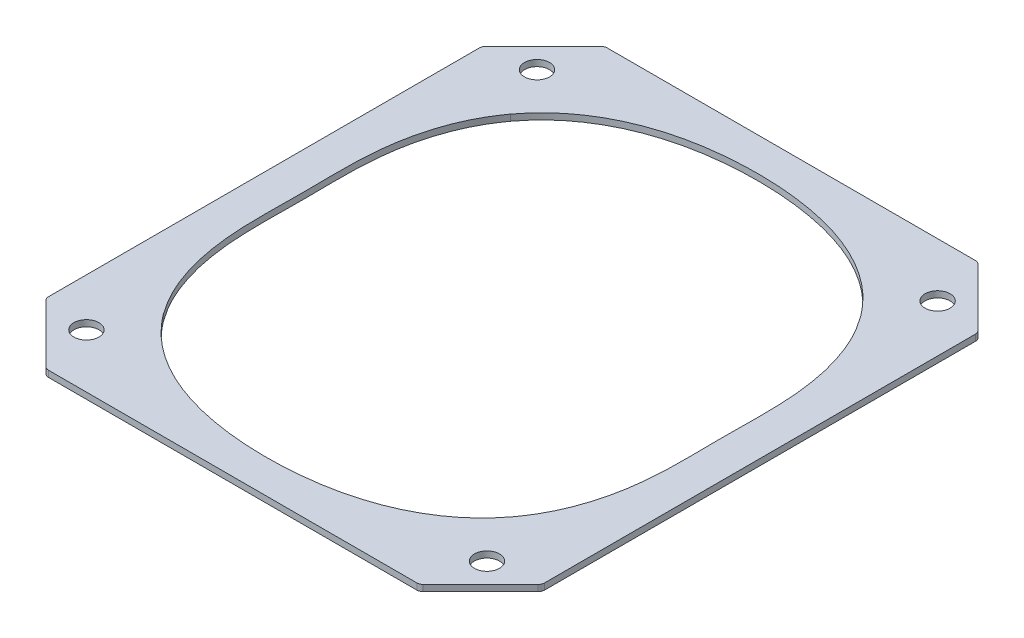
from build123d import *

# Parameters (mm, degrees)
SKETCH_1_R      = 2
EXTRUDE_1_DEPTH = 1


with BuildPart() as part:
    # 草图1 → 凸台-拉伸1 (new body)
    with BuildSketch(Plane.XZ.offset(17.798874667)):
        with BuildLine():
            Line((-395.706204946, -91.903738718), (-395.706204946, -160.757312284))
            ThreePointArc((-395.706204946, -160.757312284), (-395.630097027, -161.139937827), (-395.413356336, -161.464311369))
            Line((-395.413356336, -161.464311369), (-386.224002242, -170.653665463))
            ThreePointArc((-386.224002242, -170.653665463), (-385.8996287, -170.870406154), (-385.517003157, -170.946514073))
            Line((-385.517003157, -170.946514073), (-326.663429591, -170.946514073))
            ThreePointArc((-326.663429591, -170.946514073), (-326.280804048, -170.870406154), (-325.956430506, -170.653665463))
            Line((-325.956430506, -170.653665463), (-316.767076412, -161.464311369))
            ThreePointArc((-316.767076412, -161.464311369), (-316.550335721, -161.139937827), (-316.474227802, -160.757312284))
            Line((-316.474227802, -160.757312284), (-316.474227802, -91.903738718))
            ThreePointArc((-316.474227802, -91.903738718), (-316.550335721, -91.521113175), (-316.767076412, -91.196739633))
            Line((-316.767076412, -91.196739633), (-325.956430506, -82.007385539))
            ThreePointArc((-325.956430506, -82.007385539), (-326.280804048, -81.790644848), (-326.663429591, -81.714536929))
            Line((-326.663429591, -81.714536929), (-385.517003157, -81.714536929))
            ThreePointArc((-385.517003157, -81.714536929), (-385.8996287, -81.790644848), (-386.224002242, -82.007385539))
            Line((-386.224002242, -82.007385539), (-395.413356336, -91.196739633))
            ThreePointArc((-395.413356336, -91.196739633), (-395.630097027, -91.521113175), (-395.706204946, -91.903738718))
        make_face()
        with Locations(Location((-388.090216374, -90.330525501, 0), (0, 0, 270))):
            Circle(SKETCH_1_R, mode=Mode.SUBTRACT)
        with Locations(Location((-324.090216374, -90.330525501, 0), (0, 0, 270))):
            Circle(SKETCH_1_R, mode=Mode.SUBTRACT)
        with Locations(Location((-324.090216374, -162.330525501, 0), (0, 0, 270))):
            Circle(SKETCH_1_R, mode=Mode.SUBTRACT)
        with Locations(Location((-388.090216374, -162.330525501, 0), (0, 0, 270))):
            Circle(SKETCH_1_R, mode=Mode.SUBTRACT)
        with BuildLine():
            add(Edge.make_bspline(
                [(-328.115549043, -154.074705918), (-328.521110277, -154.59950882), (-328.935951097, -155.116186146), (-329.806169809, -156.114044907), (-330.260453195, -156.596991611), (-331.213350311, -157.520739064), (-331.707900164, -157.955834459), (-332.723346196, -158.787049549), (-333.244315955, -159.183060394), (-334.848936349, -160.309387169), (-335.972388004, -160.980823062), (-337.731348119, -161.87882583), (-338.332266211, -162.161075436), (-339.54151706, -162.683417257), (-340.150623092, -162.924120409), (-343.216470166, -164.034826977), (-345.733148117, -164.631034044), (-349.574949627, -165.220267596), (-350.866884926, -165.364900576), (-353.472874642, -165.553124722), (-354.790025345, -165.596406642), (-358.712924122, -165.592375715), (-361.308871291, -165.414172312), (-365.167942823, -164.830251401), (-366.448430665, -164.582286392), (-368.358111819, -164.109940734), (-368.99453183, -163.935229374), (-370.254220123, -163.552000312), (-370.876741702, -163.343828387), (-372.721697987, -162.668191611), (-373.921848978, -162.150340028), (-375.669495279, -161.254671187), (-376.243225263, -160.936174353), (-377.371642786, -160.256122939), (-377.926429949, -159.894182142), (-378.998067992, -159.136743168), (-379.517159279, -158.739902065), (-380.523601029, -157.91183415), (-381.01071538, -157.480351552), (-381.943283382, -156.572254171), (-382.389831683, -156.096825252), (-383.249518774, -155.109773972), (-383.661413356, -154.596803725), (-384.064883145, -154.074706668)],
                knots=[0, 0, 0, 0, 0.03125, 0.03125, 0.0625, 0.0625, 0.09375, 0.09375, 0.125, 0.125, 0.1875, 0.1875, 0.21875, 0.21875, 0.25, 0.25, 0.375, 0.375, 0.4375, 0.4375, 0.5, 0.5, 0.625, 0.625, 0.6875, 0.6875, 0.71875, 0.71875, 0.75, 0.75, 0.8125, 0.8125, 0.84375, 0.84375, 0.875, 0.875, 0.90625, 0.90625, 0.9375, 0.9375, 0.96875, 0.96875, 1, 1, 1, 1], degree=3))
            add(Edge.make_bspline(
                [(-384.064883145, -154.074706668), (-384.765407707, -153.0864132), (-385.42732094, -152.076153161), (-386.292484546, -150.488109085), (-386.559459675, -149.946579027), (-387.059276771, -148.844100038), (-387.291729743, -148.282508818), (-388.359546252, -145.46132493), (-388.939276666, -143.138851633), (-389.482665418, -139.577278966), (-389.611388551, -138.374314162), (-389.781266573, -135.965239718), (-389.822006502, -134.76010621), (-389.851460561, -132.349137318), (-389.839404608, -131.143291545), (-389.811274153, -128.731545786), (-389.79638992, -127.525661857), (-389.796563394, -125.114297943), (-389.811529784, -123.908816727), (-389.839623007, -121.497829476), (-389.851459361, -120.292359943), (-389.821592912, -117.886702654), (-389.780638177, -116.686362914), (-389.611853133, -114.293992905), (-389.484842639, -113.101884222), (-389.123813463, -110.727901972), (-388.888904034, -109.546113603), (-388.436003689, -107.783047131), (-388.268720755, -107.197789125), (-387.904764869, -106.045116113), (-387.707679153, -105.475910785), (-387.281297017, -104.352704238), (-387.051446913, -103.79896437), (-386.556282004, -102.708224696), (-386.291397985, -102.171021551), (-385.430552687, -100.590656677), (-384.768336475, -99.578768629), (-384.064883703, -98.58634508)],
                knots=[0, 0, 0, 0, 0.0625, 0.0625, 0.09375, 0.09375, 0.125, 0.125, 0.25, 0.25, 0.3125, 0.3125, 0.375, 0.375, 0.4375, 0.4375, 0.5, 0.5, 0.5625, 0.5625, 0.625, 0.625, 0.6875, 0.6875, 0.75, 0.75, 0.8125, 0.8125, 0.84375, 0.84375, 0.875, 0.875, 0.90625, 0.90625, 0.9375, 0.9375, 1, 1, 1, 1], degree=3))
            add(Edge.make_bspline(
                [(-384.064883703, -98.58634508), (-383.659322468, -98.061542177), (-383.244481649, -97.544864852), (-382.374262935, -96.547006091), (-381.91997955, -96.064059387), (-380.967082434, -95.140311933), (-380.47253258, -94.705216539), (-379.457086548, -93.874001449), (-378.93611679, -93.477990604), (-377.331496396, -92.35166383), (-376.208044739, -91.680227937), (-374.449084625, -90.782225169), (-373.848166533, -90.499975563), (-372.638915684, -89.977633743), (-372.029809651, -89.73693059), (-368.963962577, -88.626224023), (-366.447284626, -88.030016957), (-362.605483116, -87.440783404), (-361.313547818, -87.296150424), (-358.707558102, -87.107926278), (-357.390407398, -87.064644358), (-353.467508621, -87.068675286), (-350.871561452, -87.24687869), (-347.01248992, -87.830799602), (-345.732002079, -88.078764611), (-343.822320925, -88.55111027), (-343.185900913, -88.72582163), (-341.92621262, -89.109050692), (-341.303691042, -89.317222617), (-339.458734756, -89.992859393), (-338.258583765, -90.510710976), (-336.510937465, -91.406379817), (-335.937207481, -91.724876651), (-334.808789958, -92.404928066), (-334.254002795, -92.766868862), (-333.182364752, -93.524307837), (-332.663273465, -93.92114894), (-331.656831716, -94.749216855), (-331.169717364, -95.180699453), (-330.237149362, -96.088796835), (-329.790601062, -96.564225753), (-328.930913971, -97.551277033), (-328.519019389, -98.064247281), (-328.1155496, -98.586344338)],
                knots=[0, 0, 0, 0, 0.03125, 0.03125, 0.0625, 0.0625, 0.09375, 0.09375, 0.125, 0.125, 0.1875, 0.1875, 0.21875, 0.21875, 0.25, 0.25, 0.375, 0.375, 0.4375, 0.4375, 0.5, 0.5, 0.625, 0.625, 0.6875, 0.6875, 0.71875, 0.71875, 0.75, 0.75, 0.8125, 0.8125, 0.84375, 0.84375, 0.875, 0.875, 0.90625, 0.90625, 0.9375, 0.9375, 0.96875, 0.96875, 1, 1, 1, 1], degree=3))
            add(Edge.make_bspline(
                [(-328.1155496, -98.586344338), (-327.415025038, -99.574637805), (-326.753111806, -100.584897844), (-325.8879482, -102.17294192), (-325.620973071, -102.714471978), (-325.121155975, -103.816950967), (-324.888703004, -104.378542187), (-323.820886495, -107.199726075), (-323.241156082, -109.522199372), (-322.69776733, -113.083772038), (-322.569044197, -114.286736841), (-322.399166175, -116.695811285), (-322.358426246, -117.900944793), (-322.328972188, -120.311913685), (-322.341028142, -121.517759457), (-322.369158597, -123.929505216), (-322.38404283, -125.135389145), (-322.383869357, -127.546753058), (-322.368902966, -128.752234275), (-322.340809743, -131.163221525), (-322.328973388, -132.368691057), (-322.358839836, -134.774348346), (-322.399794572, -135.974688086), (-322.568579615, -138.367058095), (-322.695590109, -139.559166777), (-323.056619285, -141.933149027), (-323.291528714, -143.114937396), (-323.744429058, -144.878003867), (-323.911711993, -145.463261874), (-324.275667878, -146.615934885), (-324.472753594, -147.185140214), (-324.899135729, -148.30834676), (-325.128985833, -148.862086628), (-325.624150742, -149.952826302), (-325.889034762, -150.490029447), (-326.74988006, -152.07039432), (-327.412096271, -153.082282368), (-328.115549043, -154.074705918)],
                knots=[0, 0, 0, 0, 0.0625, 0.0625, 0.09375, 0.09375, 0.125, 0.125, 0.25, 0.25, 0.3125, 0.3125, 0.375, 0.375, 0.4375, 0.4375, 0.5, 0.5, 0.5625, 0.5625, 0.625, 0.625, 0.6875, 0.6875, 0.75, 0.75, 0.8125, 0.8125, 0.84375, 0.84375, 0.875, 0.875, 0.90625, 0.90625, 0.9375, 0.9375, 1, 1, 1, 1], degree=3))
        make_face(mode=Mode.SUBTRACT)
    extrude(amount=EXTRUDE_1_DEPTH)


solid = part.part
